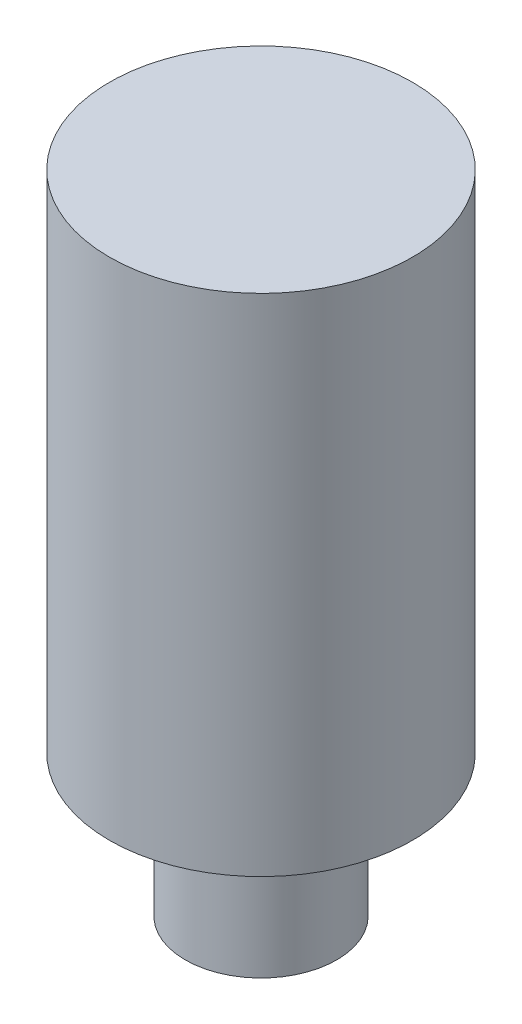
from build123d import *

# Parameters (mm, degrees)
SKETCH_1_R      = 1.5
EXTRUDE_1_DEPTH = 2.8
SKETCH_2_R      = 3
EXTRUDE_2_DEPTH = 10


with BuildPart() as part:
    # 草圖1 → 填料-伸長1 (new body)
    with BuildSketch(Plane(origin=(0, 0, 0), x_dir=(1, 0, 0), z_dir=(0, 1, 0))):
        with Locations(Location((0, 0, 0), (0, 0, 270))):
            Circle(SKETCH_1_R)
    extrude(amount=EXTRUDE_1_DEPTH)

    # 草圖2 → 填料-伸長2 (add)
    with BuildSketch(Plane(origin=(0, 2.8, 0), x_dir=(1, 0, 0), z_dir=(0, 1, 0))):
        with Locations(Location((0, 0, 0), (0, 0, 270))):
            Circle(SKETCH_2_R)
    extrude(amount=EXTRUDE_2_DEPTH)


solid = part.part
